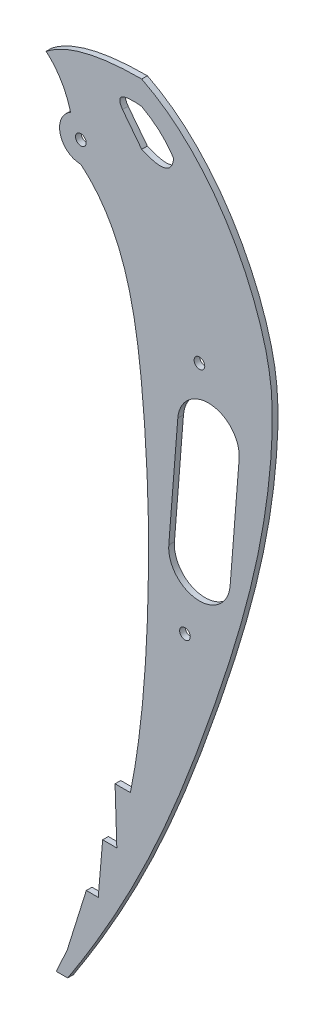
from build123d import *

# Parameters (mm, degrees)
SKETCH1_R           = 1.5
BOSS_EXTRUDE1_DEPTH = 1.6


with BuildPart() as part:
    # Sketch1 → Boss-Extrude1 (new body)
    with BuildSketch(Plane.XY):
        with BuildLine():
            Line((-20.874762199, -230), (-24.107625058, -230))
            Line((-24.107625058, -230), (-21.027218593, -223.282895617))
            Line((-21.027218593, -223.282895617), (-15.623003046, -205.993906437))
            Line((-15.623003046, -205.993906437), (-12.258960606, -205.993906437))
            Line((-12.258960606, -205.993906437), (-11.02173816, -191.31161689))
            Line((-11.02173816, -191.31161689), (-7.020102822, -191.31161689))
            Line((-7.020102822, -191.31161689), (-7.516012532, -175.88188489))
            Line((-7.516012532, -175.88188489), (-3.18703669, -175.88188489))
            add(Edge.make_bspline(
                [(-17.160324035, -29.416207169), (-8.398371011, -36.733475706), (-2.571584268, -52.968698778), (0.661081287, -79.111086987), (2.205082084, -105.054570559), (1.837795255, -131.716022715), (0.137887281, -155.634013966), (-1.771940833, -168.867741352), (-3.18703669, -175.88188489)],
                knots=[0, 0, 0, 0, 0.158482103, 0.237210378, 0.379017678, 0.53054003, 0.61967816, 0.722683629, 0.722683629, 0.722683629, 0.722683629], degree=3))
            ThreePointArc((-17.160324035, -29.416207169), (-22.971518283, -24.909532791), (-20.052992456, -18.15954764))
            add(Edge.make_bspline(
                [(-20.052992456, -18.15954764), (-21.89358239, -11.067218771), (-26.969657726, -6.716297054)],
                knots=[0, 0, 0, 1, 1, 1], degree=2))
            add(Edge.make_bspline(
                [(0, 0), (-18.413441466, 0.016463282), (-26.969657726, -6.716297054)],
                knots=[0, 0, 0, 1, 1, 1], degree=2))
            add(Edge.make_bspline(
                [(0, 0), (20.459575306, -10.212191847), (34.566285194, -39.231713158), (36.993052452, -61.467711483), (36.226383018, -93.493922569), (19.759790723, -148.8717222), (-0.764820519, -199.159242317), (-20.874762199, -230)],
                knots=[0, 0, 0, 0, 0.214563454, 0.244193693, 0.29630239, 0.633937328, 1, 1, 1, 1], degree=3))
        make_face()
        with Locations((-17.160324035, -23.416207169)):
            Circle(SKETCH1_R, mode=Mode.SUBTRACT)
        with Locations((16.280165713, -61.239474093)):
            Circle(SKETCH1_R, mode=Mode.SUBTRACT)
        with Locations((12.19348553, -129.398093126)):
            Circle(SKETCH1_R, mode=Mode.SUBTRACT)
        with BuildLine():
            Line((27.479182403, -79.073058371), (24.928147951, -111.338970141))
            ThreePointArc((24.928147951, -111.338970141), (15.596431722, -119.303218388), (7.632183475, -109.971502159))
            Line((7.632183475, -109.971502159), (10.183217928, -77.705590388))
            ThreePointArc((10.183217928, -77.705590388), (19.514934157, -69.741342142), (27.479182403, -79.073058371))
        make_face(mode=Mode.SUBTRACT)
        with BuildLine():
            add(Edge.make_bspline(
                [(0, -6.716297054), (5.911988438, -9.949488907), (8.987018452, -14.881049849)],
                knots=[0, 0, 0, 1, 1, 1], degree=2))
            add(Edge.make_bspline(
                [(0, -17.168840712), (8.415460642, -20.921041323), (8.987018452, -14.881049849)],
                knots=[0, 0, 0, 1, 1, 1], degree=2))
            add(Edge.make_bspline(
                [(-5.419356096, -10.162481193), (-1.881950972, -14.584237599), (0, -17.168840712)],
                knots=[0, 0, 0, 1, 1, 1], degree=2))
            add(Edge.make_bspline(
                [(-5.419356096, -10.162481193), (-8.382778562, -5.840753091), (0, -6.716297054)],
                knots=[0, 0, 0, 1, 1, 1], degree=2))
        make_face(mode=Mode.SUBTRACT)
    extrude(amount=BOSS_EXTRUDE1_DEPTH)


solid = part.part
